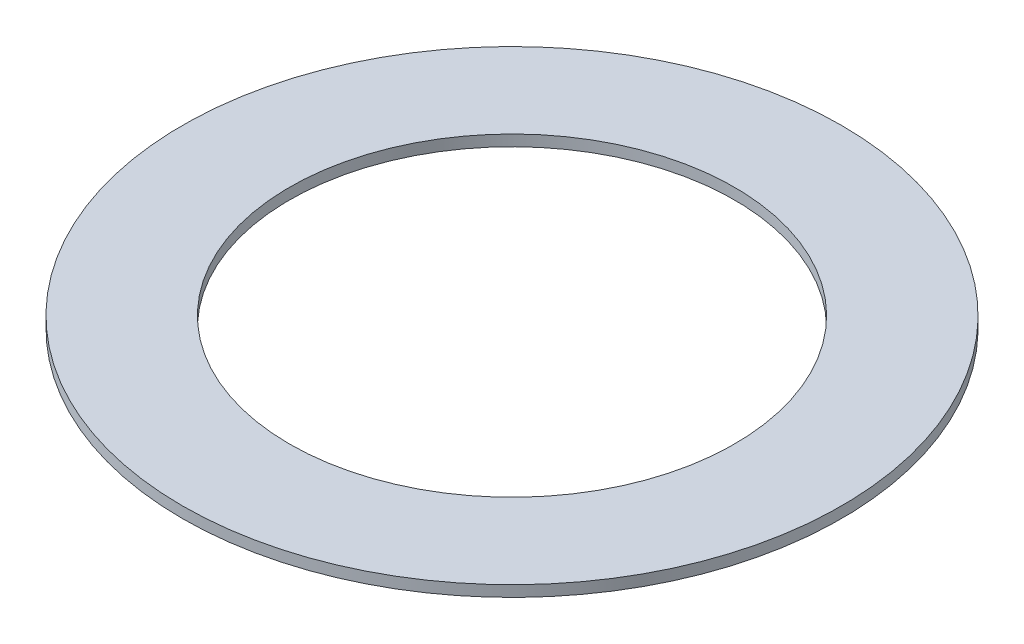
from build123d import *

# Parameters (mm, degrees)
SKETCH1_R           = 29.85
SKETCH1_R_2         = 20.15
BOSS_EXTRUDE1_DEPTH = 1


with BuildPart() as part:
    # Sketch1 → Boss-Extrude1 (new body)
    with BuildSketch(Plane(origin=(0, 0, 0), x_dir=(1, 0, 0), z_dir=(0, 1, 0))):
        with Locations(Location((0, 0, 0), (0, 0, 270))):
            Circle(SKETCH1_R)
        with Locations(Location((0, 0, 0), (0, 0, 270))):
            Circle(SKETCH1_R_2, mode=Mode.SUBTRACT)
    extrude(amount=BOSS_EXTRUDE1_DEPTH)


solid = part.part
